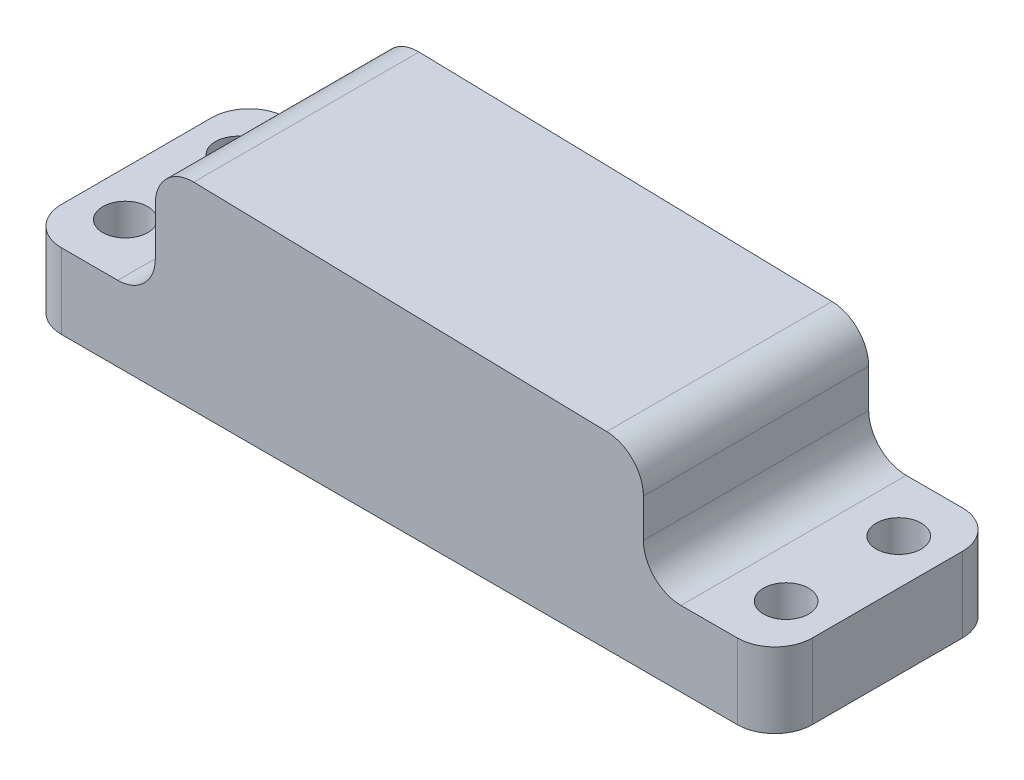
from build123d import *

# Parameters (mm, degrees)
BOSS_EXTRUDE1_DEPTH                     = 60
CBORE_FOR_M5_HEX_HEAD_BOLT1_D           = 8
CBORE_FOR_M5_HEX_HEAD_BOLT1_CBORE_D     = 12
CBORE_FOR_M5_HEX_HEAD_BOLT1_CBORE_DEPTH = 10
MIRROR2_COPY_1_D                        = 8
MIRROR2_COPY_1_CBORE_D                  = 12
MIRROR2_COPY_1_CBORE_DEPTH              = 10
FILLET1_R                               = 10
FILLET2_R                               = 10


with BuildPart() as part:
    # Sketch1 → Boss-Extrude1 (new body)
    with BuildSketch(Plane.XY):
        Polygon((0, 0), (0, 20), (35, 20), (35, 53), (165, 50), (165, 20), (200, 20), (200, 0), align=None)
    extrude(amount=BOSS_EXTRUDE1_DEPTH)

    # CBORE for M5 Hex Head Bolt1 (through all)
    with Locations(Plane(origin=(0, 20, 0), x_dir=(1, 0, 0), z_dir=(0, 1, 0))):
        with Locations((12, -45)):
            cbore_for_m5_hex_head_bolt1 = CounterBoreHole(CBORE_FOR_M5_HEX_HEAD_BOLT1_D / 2, CBORE_FOR_M5_HEX_HEAD_BOLT1_CBORE_D / 2, CBORE_FOR_M5_HEX_HEAD_BOLT1_CBORE_DEPTH)

    # Mirror1: CBORE for M5 Hex Head Bolt1 across plane
    add(cbore_for_m5_hex_head_bolt1.mirror(Plane.XY.offset(30)), mode=Mode.SUBTRACT)

    # Mirror2: CBORE for M5 Hex Head Bolt1 across plane
    add(cbore_for_m5_hex_head_bolt1.mirror(Plane(origin=(100, 0, 0), x_dir=(0, 0, 1), z_dir=(1, 0, 0))), mode=Mode.SUBTRACT)

    # Mirror2 copy 1 (through all)
    with Locations(Plane(origin=(200, 20, 60), x_dir=(-1, 0, 0), z_dir=(0, 1, 0))):
        with Locations((12, -45)):
            CounterBoreHole(MIRROR2_COPY_1_D / 2, MIRROR2_COPY_1_CBORE_D / 2, MIRROR2_COPY_1_CBORE_DEPTH)

    # Fillet1
    fillet1_edges = [part.edges().sort_by_distance(p)[0] for p in [
        (165, 20, 30),
        (165, 50, 30),
        (35, 53, 30),
        (35, 20, 30),
    ]]
    fillet(fillet1_edges, radius=FILLET1_R)

    # Fillet2
    fillet2_edges = [part.edges().sort_by_distance(p)[0] for p in [
        (0, 10, 0),
        (200, 10, 0),
        (0, 10, 60),
        (200, 10, 60),
    ]]
    fillet(fillet2_edges, radius=FILLET2_R)


solid = part.part
